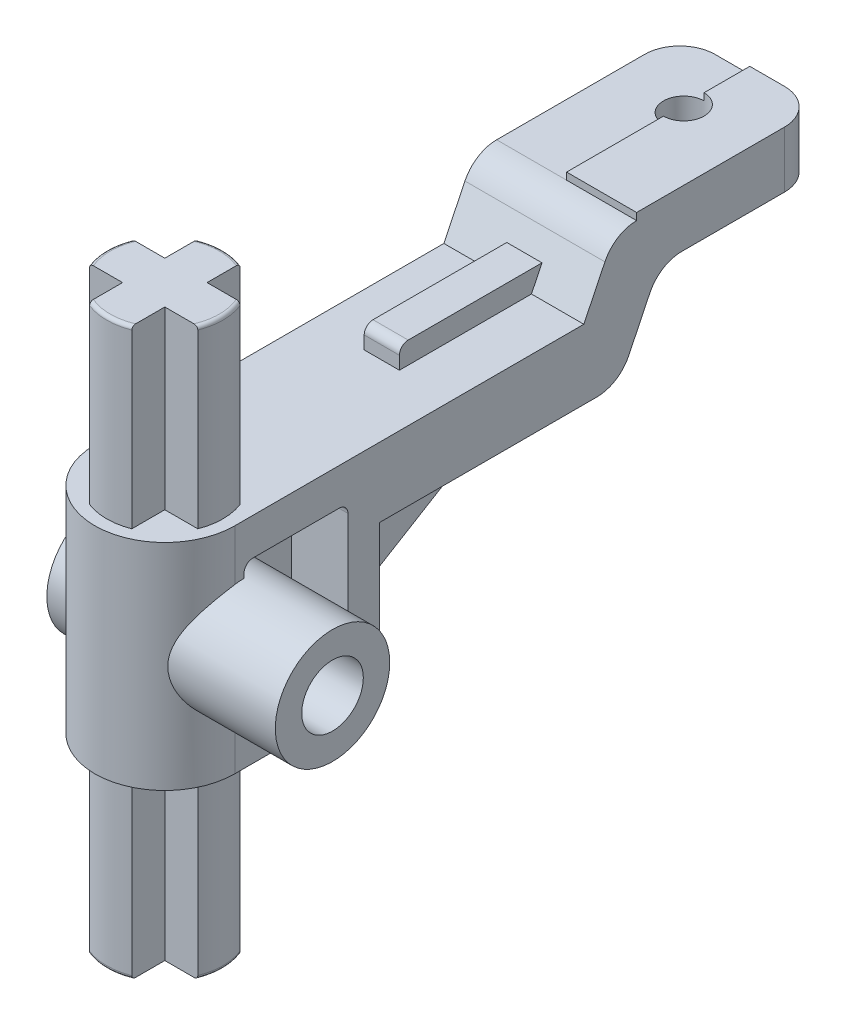
from build123d import *

# Parameters (mm, degrees)
SALIENTE_EXTRUIR1_DEPTH             = 7.95
CORTAR_EXTRUIR1_DEPTH               = 42.190806013
SALIENTE_EXTRUIR2_DEPTH             = 0.95
REDONDEO1_R                         = 2
CROQUIS5_W                          = 8.098391508
CROQUIS5_H                          = 3
SALIENTE_EXTRUIR3_DEPTH             = 1
REDONDEO2_R                         = 0.5
REDONDEO3_R                         = 1
SALIENTE_EXTRUIR5_DEPTH             = 16.075
SALIENTE_EXTRUIR6_START             = -2.8
SALIENTE_EXTRUIR6_DEPTH             = 3.2
REDONDEO4_R                         = 2
CORTAR_EXTRUIR2_REACH               = 48.175
CROQUIS9_R                          = 1.15
REDONDEO5_R                         = 0.2
CROQUIS10_R                         = 3.25
SALIENTE_EXTRUIR7_DEPTH             = 9
SALIENTE_EXTRUIR7_DIRECTION_2_REACH = 45.49
CORTAR_EXTRUIR3_DEPTH               = 3.2
REDONDEO6_R                         = 0.5
REDONDEO6_OF_SIMETR_A4_R            = 0.5
CORTAR_EXTRUIR4_REACH               = 47.21
CROQUIS12_R                         = 1.75
CROQUIS13_W                         = 41.090174937
CROQUIS13_H                         = 34.933198672
CORTAR_EXTRUIR6_DEPTH               = 33


with BuildPart() as part:
    # Croquis1 → Saliente-Extruir1 (new body)
    with BuildSketch(Plane(origin=(0, 0, 0), x_dir=(0, 0, -1), z_dir=(1, 0, 0))):
        Polygon((0, 0), (0, 12.2), (23.8, 12.2), (25.543157895, 15.8), (37.2, 15.8), (37.2, 13), (28.1, 13), (25.8, 8.25), (12.2, 8.25), (12.2, 0), align=None)
    extrude(amount=SALIENTE_EXTRUIR1_DEPTH)

    # Croquis2 → Cortar-Extruir1 (cut, through all)
    with BuildSketch(Plane(origin=(0, 15.8, 0), x_dir=(1, 0, 0), z_dir=(0, 1, 0))):
        with BuildLine():
            Line((0, 3.975), (0, -1.023351504))
            Line((0, -1.023351504), (7.95, -1.023351504))
            Line((7.95, -1.023351504), (7.95, 3.975))
            ThreePointArc((7.95, 3.975), (3.975, 0), (0, 3.975))
        make_face()
    extrude(amount=-CORTAR_EXTRUIR1_DEPTH, mode=Mode.SUBTRACT)

    # Croquis3 → Saliente-Extruir2 (add, symmetric)
    with BuildSketch(Plane.ZY.offset(-3.975)):
        Polygon((-23.8, 8.25), (-12.2, 1.25), (-12.2, 8.25), align=None)
    extrude(amount=SALIENTE_EXTRUIR2_DEPTH, both=True)

    # Redondeo1
    redondeo1_edges = [part.edges().sort_by_distance(p)[0] for p in [
        (0, 14.4, -37.2),
        (3.975, 15.8, -25.543157895),
        (3.975, 13, -28.1),
        (3.975, 8.25, -25.8),
        (7.95, 14.4, -37.2),
    ]]
    fillet(redondeo1_edges, radius=REDONDEO1_R)

    # Croquis5 → Saliente-Extruir3 (add, symmetric)
    with BuildSketch(Plane.ZY.offset(-3.975)):
        with Locations((-20.349195754, 11.935808548)):
            Rectangle(CROQUIS5_W, CROQUIS5_H)
    extrude(amount=SALIENTE_EXTRUIR3_DEPTH, both=True)

    # Redondeo2
    redondeo2_edges = [part.edges().sort_by_distance(p)[0] for p in [
        (3.975, 13.435808548, -16.3),
    ]]
    fillet(redondeo2_edges, radius=REDONDEO2_R)

    # Redondeo3
    redondeo3_edges = [part.edges().sort_by_distance(p)[0] for p in [
        (3.975, 0, -12.2),
    ]]
    fillet(redondeo3_edges, radius=REDONDEO3_R)

    # Croquis6 → Saliente-Extruir5 (add, symmetric)
    with BuildSketch(Plane(origin=(0, 6.1, 0), x_dir=(1, 0, 0), z_dir=(0, 1, 0))):
        with BuildLine():
            Line((2.775, 7.04908523), (2.775, 5.175))
            Line((2.775, 5.175), (0.90091477, 5.175))
            ThreePointArc((0.90091477, 5.175), (0.675, 3.975), (0.90091477, 2.775))
            Line((0.90091477, 2.775), (2.775, 2.775))
            Line((2.775, 2.775), (2.775, 0.90091477))
            ThreePointArc((2.775, 0.90091477), (3.975, 0.675), (5.175, 0.90091477))
            Line((5.175, 0.90091477), (5.175, 2.775))
            Line((5.175, 2.775), (7.04908523, 2.775))
            ThreePointArc((7.04908523, 2.775), (7.275, 3.975), (7.04908523, 5.175))
            Line((7.04908523, 5.175), (5.175, 5.175))
            Line((5.175, 5.175), (5.175, 7.04908523))
            ThreePointArc((5.175, 7.04908523), (3.975, 7.275), (2.775, 7.04908523))
        make_face()
    extrude(amount=SALIENTE_EXTRUIR5_DEPTH, both=True)

    # Croquis8 → Saliente-Extruir6 (add)
    with BuildSketch(Plane(origin=(0, 15.8, 0), x_dir=(1, 0, 0), z_dir=(0, 1, 0)).offset(SALIENTE_EXTRUIR6_START)):
        Polygon((3.975, 37.2), (5.95, 37.2), (7.95, 37.2), (7.95, 26.796861802), (3.975, 26.796861802), align=None)
    extrude(amount=SALIENTE_EXTRUIR6_DEPTH)

    # Redondeo4
    redondeo4_edges = [part.edges().sort_by_distance(p)[0] for p in [
        (7.95, 14.6, -37.2),
    ]]
    fillet(redondeo4_edges, radius=REDONDEO4_R)

    # Croquis9 → Cortar-Extruir2 (cut, up to next)
    with BuildSketch(Plane(origin=(0, 16.2, 0), x_dir=(1, 0, 0), z_dir=(0, 1, 0)), mode=Mode.PRIVATE) as cortar_extruir2_sk1:
        with Locations(Location((3.975, 33.45, 0), (0, 0, 270))):
            Circle(CROQUIS9_R)
    cortar_extruir2_tool1 = extrude(cortar_extruir2_sk1.sketch, amount=-CORTAR_EXTRUIR2_REACH, mode=Mode.PRIVATE) & part.part
    add(cortar_extruir2_tool1.solids().sort_by_distance((3.975, 16.2, -33.45))[0], mode=Mode.SUBTRACT)

    # Redondeo5
    redondeo5_edges = [part.edges().sort_by_distance(p)[0] for p in [
        (3.975, -9.975, -7.275),
        (0.675, -9.975, -3.975),
        (3.975, -9.975, -0.675),
        (7.275, -9.975, -3.975),
        (3.975, 22.175, -7.275),
        (0.675, 22.175, -3.975),
        (3.975, 22.175, -0.675),
        (7.275, 22.175, -3.975),
    ]]
    fillet(redondeo5_edges, radius=REDONDEO5_R)

    # Croquis10 → Saliente-Extruir7 (add)
    with BuildSketch(Plane(origin=(3.975, 0, 0), x_dir=(0, 0, -1), z_dir=(1, 0, 0))):
        with Locations((4.5, 6.1)):
            Circle(CROQUIS10_R)
    extrude(amount=SALIENTE_EXTRUIR7_DEPTH)

    # Saliente-Extruir7 direction 2: up to this face of the body (flat: up to its plane)
    saliente_extruir7_direction_2_end = Plane(part.part.faces().sort_by_distance((0, 8.735177915, -15.168906587))[0])
    # Croquis10 → Saliente-Extruir7 direction 2 (add, up to the picked face)
    with BuildSketch(Plane(origin=(3.975, 0, 0), x_dir=(0, 0, -1), z_dir=(1, 0, 0)), mode=Mode.PRIVATE) as saliente_extruir7_direction_2_sk1:
        with Locations((4.5, 6.1)):
            Circle(CROQUIS10_R)
    saliente_extruir7_direction_2_tool1 = split(extrude(saliente_extruir7_direction_2_sk1.sketch, amount=-SALIENTE_EXTRUIR7_DIRECTION_2_REACH, mode=Mode.PRIVATE), bisect_by=saliente_extruir7_direction_2_end, keep=Keep.BOTH, mode=Mode.PRIVATE)
    add(saliente_extruir7_direction_2_tool1.solids().sort_by(Axis((3.975, 6.1, -4.5), (-1, 0, 0)))[0])

    # Croquis11 → Cortar-Extruir3 (cut)
    with BuildSketch(Plane.ZY):
        with BuildLine():
            Line((-10.4, 10.1), (-4.5, 10.1))
            Line((-4.5, 10.1), (-4.5, 9.35))
            ThreePointArc((-4.5, 9.35), (-7.75, 6.1), (-4.5, 2.85))
            Line((-4.5, 2.85), (-4.5, 1.8))
            Line((-4.5, 1.8), (-10.4, 1.8))
            Line((-10.4, 1.8), (-10.4, 10.1))
        make_face()
    cortar_extruir3 = extrude(amount=-CORTAR_EXTRUIR3_DEPTH, mode=Mode.SUBTRACT)

    # Redondeo6
    redondeo6_edges = [part.edges().sort_by_distance(p)[0] for p in [
        (1.6, 1.8, -10.4),
        (1.6, 10.1, -10.4),
        (1.6, 10.1, -4.5),
        (1.6, 1.8, -4.5),
    ]]
    fillet(redondeo6_edges, radius=REDONDEO6_R)

    # Simetría4: Cortar-Extruir3 across plane
    add(cortar_extruir3.mirror(Plane(origin=(3.975, 0, 0), x_dir=(0, 0, 1), z_dir=(1, 0, 0))), mode=Mode.SUBTRACT)

    # Redondeo6 of Simetría4
    redondeo6_of_simetr_a4_edges = [part.edges().sort_by_distance(p)[0] for p in [
        (6.35, 1.8, -10.4),
        (6.35, 10.1, -10.4),
        (6.35, 10.1, -4.5),
        (6.35, 1.8, -4.5),
    ]]
    fillet(redondeo6_of_simetr_a4_edges, radius=REDONDEO6_OF_SIMETR_A4_R)

    # Croquis12 → Cortar-Extruir4 (cut, up to next)
    with BuildSketch(Plane(origin=(12.975, 0, 0), x_dir=(0, 0, -1), z_dir=(1, 0, 0)), mode=Mode.PRIVATE) as cortar_extruir4_sk1:
        with Locations((4.5, 6.1)):
            Circle(CROQUIS12_R)
    cortar_extruir4_tool1 = extrude(cortar_extruir4_sk1.sketch, amount=-CORTAR_EXTRUIR4_REACH, mode=Mode.PRIVATE) & part.part
    add(cortar_extruir4_tool1.solids().sort_by_distance((12.975, 6.1, -4.5))[0], mode=Mode.SUBTRACT)


with BuildPart() as body_2:
    # Simetría6: mirrored copy
    add(part.part.mirror(Plane.ZY.offset(10)))

    # Croquis13 → Cortar-Extruir6 (cut)
    with BuildSketch(Plane(origin=(-10, 0, 0), x_dir=(0, 0, -1), z_dir=(1, 0, 0))):
        with Locations((19.577078705, 6.209166246)):
            Rectangle(CROQUIS13_W, CROQUIS13_H)
    extrude(amount=-CORTAR_EXTRUIR6_DEPTH, mode=Mode.SUBTRACT)


solid = part.part
